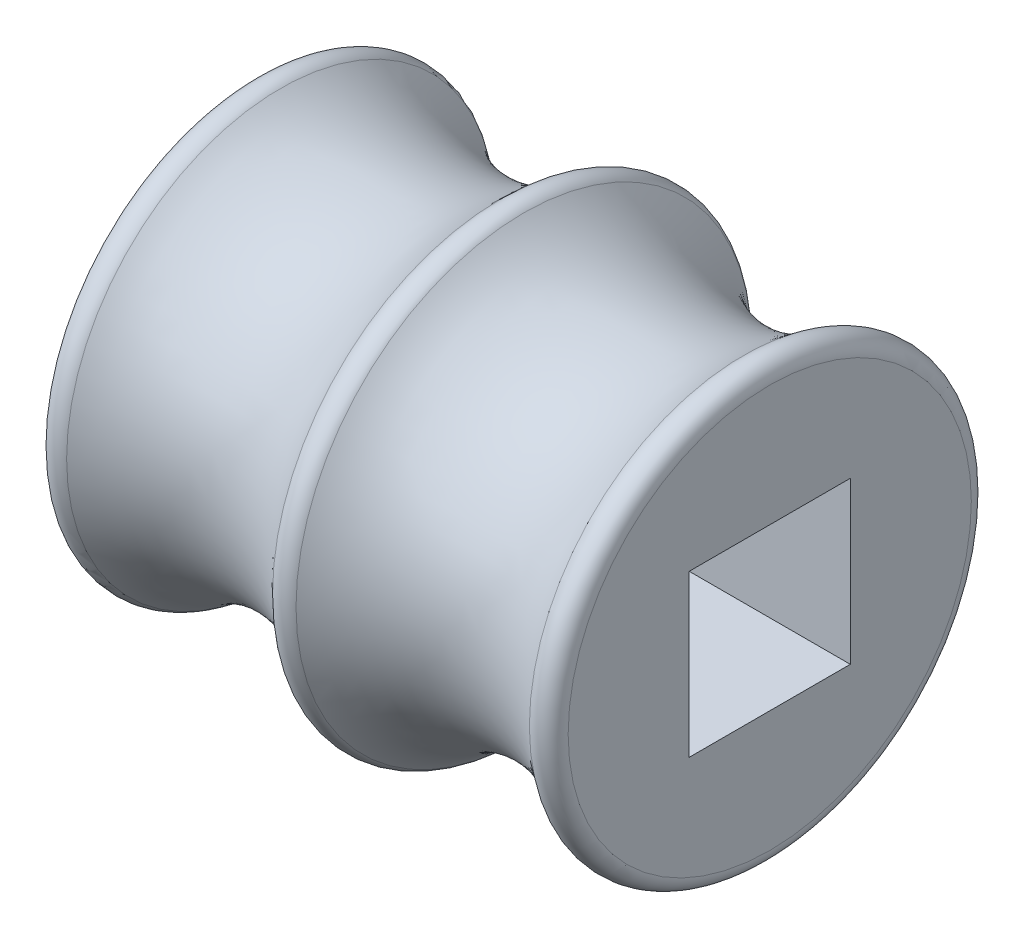
from build123d import *

# Parameters (mm, degrees)
SKETCH3_W          = 6.35
SKETCH3_H          = 6.35
CUT_EXTRUDE1_DEPTH = 17.872369425
FILLET1_R          = 0.635


with BuildPart() as part:
    # Sketch2 → Revolve1 (revolve)
    with BuildSketch(Plane.XY, mode=Mode.PRIVATE) as revolve1_sk:
        with BuildLine():
            Line((0, 2.286), (10.16, 2.286))
            Line((10.16, 2.286), (10.16, 9.525))
            ThreePointArc((10.16, 9.525), (5.08, 6.985), (0, 9.525))
            Line((0, 9.525), (0, 2.286))
        make_face()
    revolve1 = revolve(revolve1_sk.sketch.rotate(Axis((0, 0, 0), (1, 0, 0)), 90), axis=Axis((0, 0, 0), (1, 0, 0)))

    # Sketch3 → Cut-Extrude1 (cut, through all)
    with BuildSketch(Plane(origin=(10.16, 0, 0), x_dir=(0, 0, -1), z_dir=(1, 0, 0))):
        Rectangle(SKETCH3_W, SKETCH3_H)
    cut_extrude1 = extrude(amount=-CUT_EXTRUDE1_DEPTH, mode=Mode.SUBTRACT)

    # Mirror1: Revolve1, Cut-Extrude1 across plane
    add(revolve1.mirror(Plane(origin=(0, 2.286, 0), x_dir=(0, 0, 1), z_dir=(1, 0, 0))))
    add(cut_extrude1.mirror(Plane(origin=(0, 2.286, 0), x_dir=(0, 0, 1), z_dir=(1, 0, 0))), mode=Mode.SUBTRACT)

    # Fillet1
    fillet1_edges = [part.edges().sort_by_distance(p)[0] for p in [
        (-10.16, 0, -9.525),
        (0, 0, -9.525),
        (10.16, 0, -9.525),
    ]]
    fillet(fillet1_edges, radius=FILLET1_R)


solid = part.part
